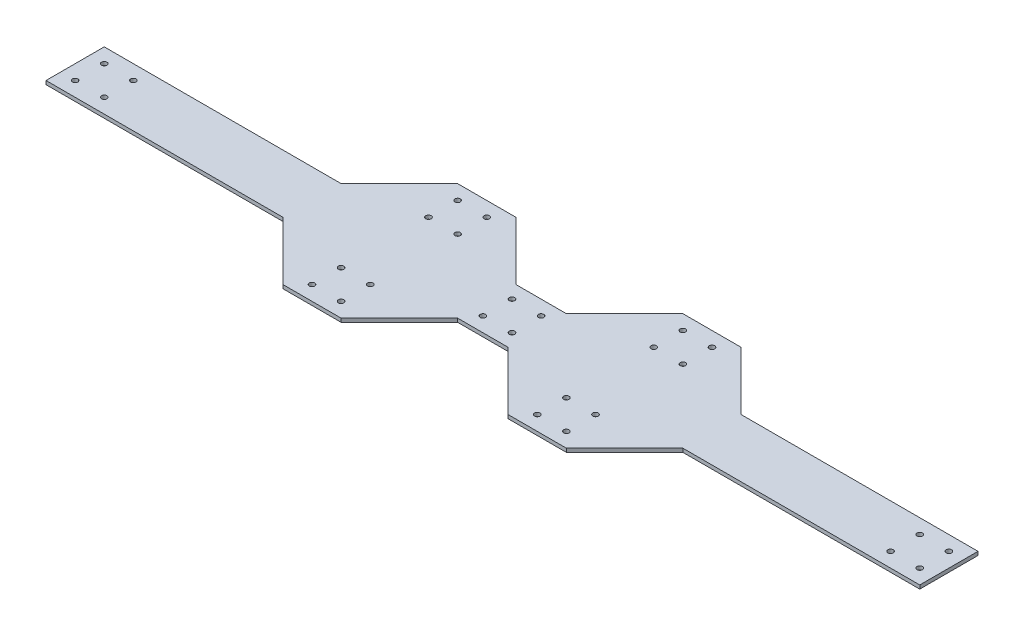
from build123d import *

# Parameters (mm, degrees)
BOSS_EXTRUDE1_DEPTH     = 3.175
CUT_EXTRUDE1_DEPTH      = 389.558258984
CUT_EXTRUDE1_DEPTH_BACK = 389.558258984
SKETCH3_R               = 2.38125


with BuildPart() as part:
    # Sketch2 → Boss-Extrude1 (new body)
    with BuildSketch(Plane(origin=(0, 0, 0), x_dir=(1, 0, 0), z_dir=(0, 1, 0))):
        Polygon((22.0265625, 25.4), (72.8265625, 76.2), (123.6265625, 76.2), (174.4265625, 25.4), (381, 25.4), (381, -25.4), (174.4265625, -25.4), (123.6265625, -76.2), (72.8265625, -76.2), (22.0265625, -25.4), (-22.0265625, -25.4), (-72.8265625, -76.2), (-123.6265625, -76.2), (-174.4265625, -25.4), (-381, -25.4), (-381, 25.4), (-174.4265625, 25.4), (-123.6265625, 76.2), (-72.8265625, 76.2), (-22.0265625, 25.4), align=None)
    extrude(amount=BOSS_EXTRUDE1_DEPTH)

    # Sketch3 → Cut-Extrude1 (cut, two sides: drawn at the far end of the back side and taken through both)
    with BuildSketch(Plane(origin=(0, 3.175, 0), x_dir=(1, 0, 0), z_dir=(0, 1, 0)).offset(-CUT_EXTRUDE1_DEPTH_BACK)):
        with Locations(Location((-110.9265625, 63.5, 0), (0, 0, 270))):
            Circle(SKETCH3_R)
        with Locations(Location((-85.5265625, 63.5, 0), (0, 0, 270))):
            Circle(SKETCH3_R)
        with Locations(Location((-110.9265625, 38.1, 0), (0, 0, 270))):
            Circle(SKETCH3_R)
        with Locations(Location((-85.5265625, 38.1, 0), (0, 0, 270))):
            Circle(SKETCH3_R)
        with Locations(Location((-85.5265625, -38.1, 0), (0, 0, 270))):
            Circle(SKETCH3_R)
        with Locations(Location((-110.9265625, -38.1, 0), (0, 0, 270))):
            Circle(SKETCH3_R)
        with Locations(Location((-85.5265625, -63.5, 0), (0, 0, 270))):
            Circle(SKETCH3_R)
        with Locations(Location((-110.9265625, -63.5, 0), (0, 0, 270))):
            Circle(SKETCH3_R)
        with Locations(Location((110.9265625, -63.5, 0), (0, 0, 270))):
            Circle(SKETCH3_R)
        with Locations(Location((85.5265625, -63.5, 0), (0, 0, 270))):
            Circle(SKETCH3_R)
        with Locations(Location((110.9265625, -38.1, 0), (0, 0, 270))):
            Circle(SKETCH3_R)
        with Locations(Location((85.5265625, -38.1, 0), (0, 0, 270))):
            Circle(SKETCH3_R)
        with Locations(Location((85.5265625, 38.1, 0), (0, 0, 270))):
            Circle(SKETCH3_R)
        with Locations(Location((110.9265625, 38.1, 0), (0, 0, 270))):
            Circle(SKETCH3_R)
        with Locations(Location((85.5265625, 63.5, 0), (0, 0, 270))):
            Circle(SKETCH3_R)
        with Locations(Location((110.9265625, 63.5, 0), (0, 0, 270))):
            Circle(SKETCH3_R)
        with Locations(Location((-342.9, -12.7, 0), (0, 0, 270))):
            Circle(SKETCH3_R)
        with Locations(Location((-368.3, -12.7, 0), (0, 0, 270))):
            Circle(SKETCH3_R)
        with Locations(Location((-368.3, 12.7, 0), (0, 0, 270))):
            Circle(SKETCH3_R)
        with Locations(Location((-342.9, 12.7, 0), (0, 0, 270))):
            Circle(SKETCH3_R)
        with Locations(Location((342.9, 12.7, 0), (0, 0, 270))):
            Circle(SKETCH3_R)
        with Locations(Location((368.3, 12.7, 0), (0, 0, 270))):
            Circle(SKETCH3_R)
        with Locations(Location((368.3, -12.7, 0), (0, 0, 270))):
            Circle(SKETCH3_R)
        with Locations(Location((342.9, -12.7, 0), (0, 0, 270))):
            Circle(SKETCH3_R)
        with Locations(Location((-12.7, 12.7, 0), (0, 0, 270))):
            Circle(SKETCH3_R)
        with Locations(Location((12.7, 12.7, 0), (0, 0, 270))):
            Circle(SKETCH3_R)
        with Locations(Location((12.7, -12.7, 0), (0, 0, 270))):
            Circle(SKETCH3_R)
        with Locations(Location((-12.7, -12.7, 0), (0, 0, 270))):
            Circle(SKETCH3_R)
    extrude(amount=CUT_EXTRUDE1_DEPTH + CUT_EXTRUDE1_DEPTH_BACK, mode=Mode.SUBTRACT)


solid = part.part
